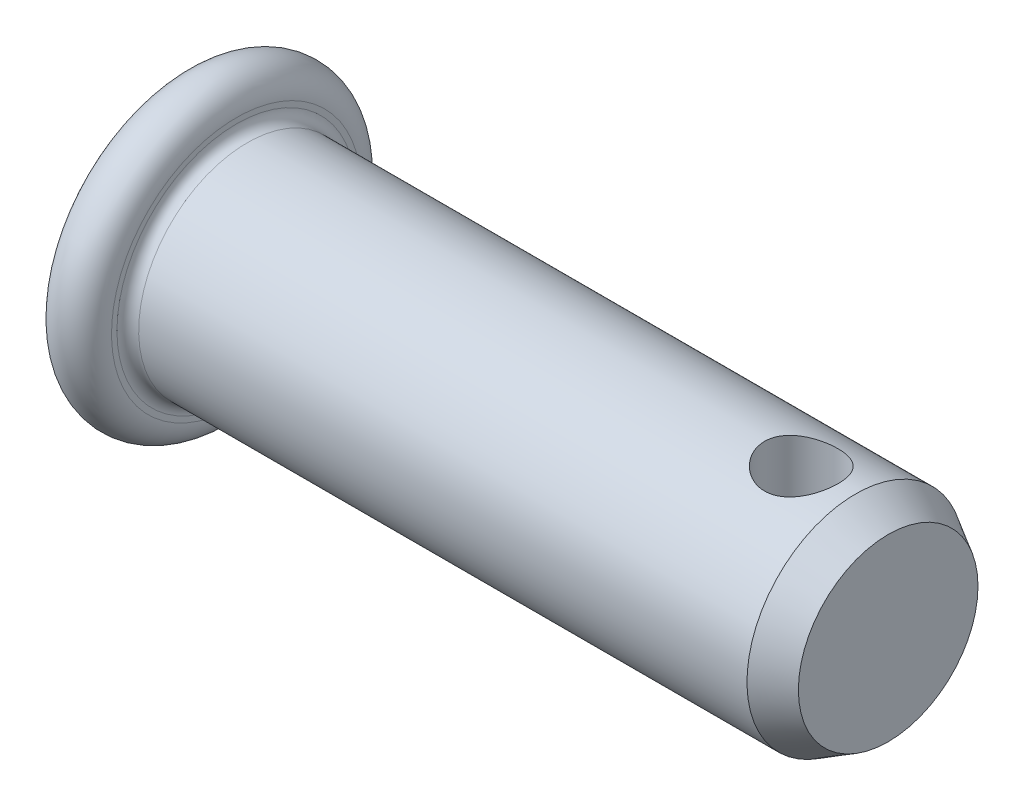
from build123d import *

# Parameters (mm, degrees)
CHAMFER1_R      = 0.5
HOLE_DEPTH      = 34.974255
HOLE_DEPTH_BACK = 34.974255
SKETCH2_R       = 1.69


with BuildPart() as part:
    # Sketch1 → BaseBody (revolve)
    with BuildSketch(Plane.XY, mode=Mode.PRIVATE) as basebody_sk:
        with BuildLine():
            Line((32.5, 0), (0, 0))
            Line((0, 0), (0, 5.75))
            ThreePointArc((0, 5.75), (1.25, 7), (2.5, 5.75))
            Line((2.5, 5.75), (2.5, 5))
            Line((2.5, 5), (31, 5))
            Line((31, 5), (32.5, 4.133974596))
            Line((32.5, 4.133974596), (32.5, 0))
        make_face()
    revolve(basebody_sk.sketch.rotate(Axis((-19.830028721, 0, 0), (1, 0, 0)), 180), axis=Axis((-19.830028721, 0, 0), (1, 0, 0)))

    # Chamfer1
    chamfer1_edges = [part.edges().sort_by_distance(p)[0] for p in [
        (2.5, 5, 0),
    ]]
    fillet(chamfer1_edges, radius=CHAMFER1_R)

    # Sketch2 → Hole (cut, two sides: drawn at the far end of the back side and taken through both)
    with BuildSketch(Plane(origin=(0, 0, 0), x_dir=(1, 0, 0), z_dir=(0, 1, 0)).offset(-HOLE_DEPTH_BACK)):
        with Locations(Location((28.5, 0, 0), (0, 0, 270))):
            Circle(SKETCH2_R)
    extrude(amount=HOLE_DEPTH + HOLE_DEPTH_BACK, mode=Mode.SUBTRACT)


solid = part.part
